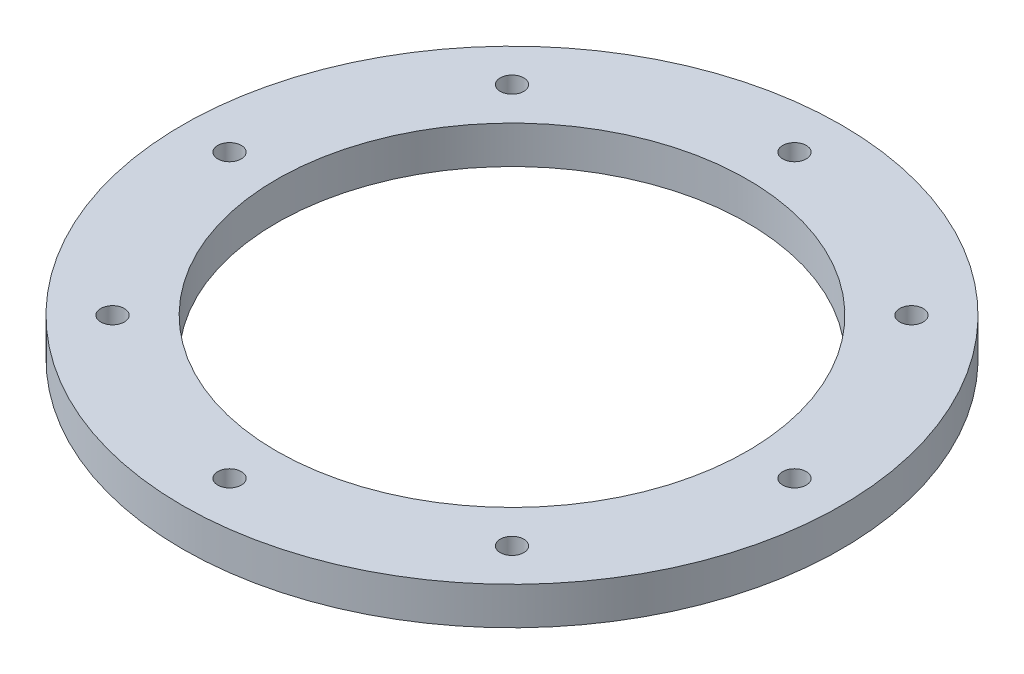
from build123d import *

# Parameters (mm, degrees)
SKETCH1_R           = 35
SKETCH1_R_2         = 25
SKETCH1_R_3         = 1.25
BOSS_EXTRUDE1_DEPTH = 4


with BuildPart() as part:
    # Sketch1 → Boss-Extrude1 (new body)
    with BuildSketch(Plane(origin=(0, 0, 0), x_dir=(1, 0, 0), z_dir=(0, 1, 0))):
        with Locations(Location((0, 0, 0), (0, 0, 270))):
            Circle(SKETCH1_R)
        with Locations(Location((0, 0, 0), (0, 0, 270))):
            Circle(SKETCH1_R_2, mode=Mode.SUBTRACT)
        with Locations(Location((0, 30, 0), (0, 0, 270))):
            Circle(SKETCH1_R_3, mode=Mode.SUBTRACT)
        with Locations(Location((21.213203436, 21.213203436, 0), (0, 0, 270))):
            Circle(SKETCH1_R_3, mode=Mode.SUBTRACT)
        with Locations(Location((30, 0, 0), (0, 0, 270))):
            Circle(SKETCH1_R_3, mode=Mode.SUBTRACT)
        with Locations(Location((-21.213203436, 21.213203436, 0), (0, 0, 270))):
            Circle(SKETCH1_R_3, mode=Mode.SUBTRACT)
        with Locations(Location((-30, 0, 0), (0, 0, 270))):
            Circle(SKETCH1_R_3, mode=Mode.SUBTRACT)
        with Locations(Location((-21.213203436, -21.213203436, 0), (0, 0, 270))):
            Circle(SKETCH1_R_3, mode=Mode.SUBTRACT)
        with Locations(Location((0, -30, 0), (0, 0, 270))):
            Circle(SKETCH1_R_3, mode=Mode.SUBTRACT)
        with Locations(Location((21.213203436, -21.213203436, 0), (0, 0, 270))):
            Circle(SKETCH1_R_3, mode=Mode.SUBTRACT)
    extrude(amount=BOSS_EXTRUDE1_DEPTH)


solid = part.part
